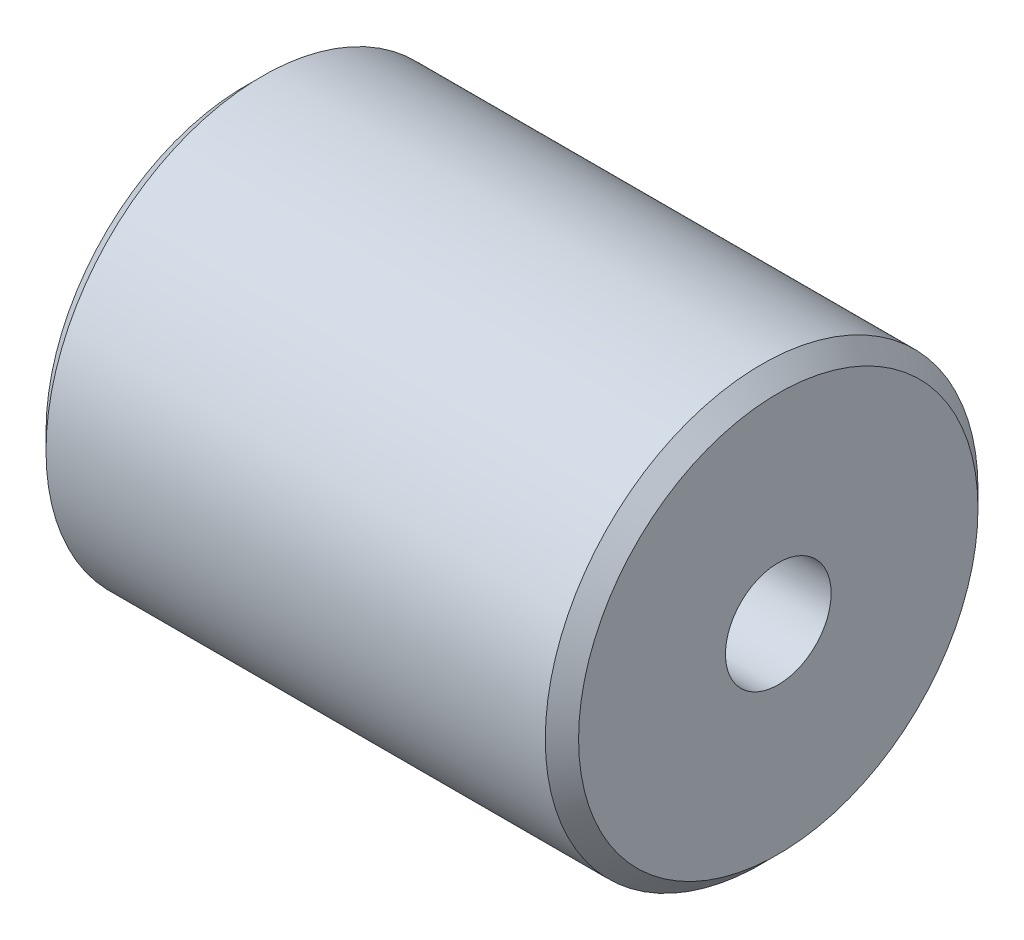
from build123d import *

# Parameters (mm, degrees)
SKETCH1_R           = 13
BOSS_EXTRUDE1_DEPTH = 32
SKETCH2_R           = 3.175
CUT_EXTRUDE1_DEPTH  = 37.905284174
SKETCH3_R           = 5
CUT_EXTRUDE2_DEPTH  = 20
CHAMFER1_SIZE       = 1


with BuildPart() as part:
    # Sketch1 → Boss-Extrude1 (new body)
    with BuildSketch(Plane(origin=(0, 0, 0), x_dir=(0, 0, -1), z_dir=(1, 0, 0))):
        Circle(SKETCH1_R)
    extrude(amount=BOSS_EXTRUDE1_DEPTH)

    # Sketch2 → Cut-Extrude1 (cut, through all)
    with BuildSketch(Plane(origin=(32, 0, 0), x_dir=(0, 0, -1), z_dir=(1, 0, 0))):
        Circle(SKETCH2_R)
    extrude(amount=-CUT_EXTRUDE1_DEPTH, mode=Mode.SUBTRACT)

    # Sketch3 → Cut-Extrude2 (cut)
    with BuildSketch(Plane.ZY):
        Circle(SKETCH3_R)
    extrude(amount=-CUT_EXTRUDE2_DEPTH, mode=Mode.SUBTRACT)

    # Chamfer1
    chamfer1_edges = [part.edges().sort_by_distance(p)[0] for p in [
        (0, 0, 13),
        (32, 0, 13),
    ]]
    chamfer(chamfer1_edges, length=CHAMFER1_SIZE)


solid = part.part
